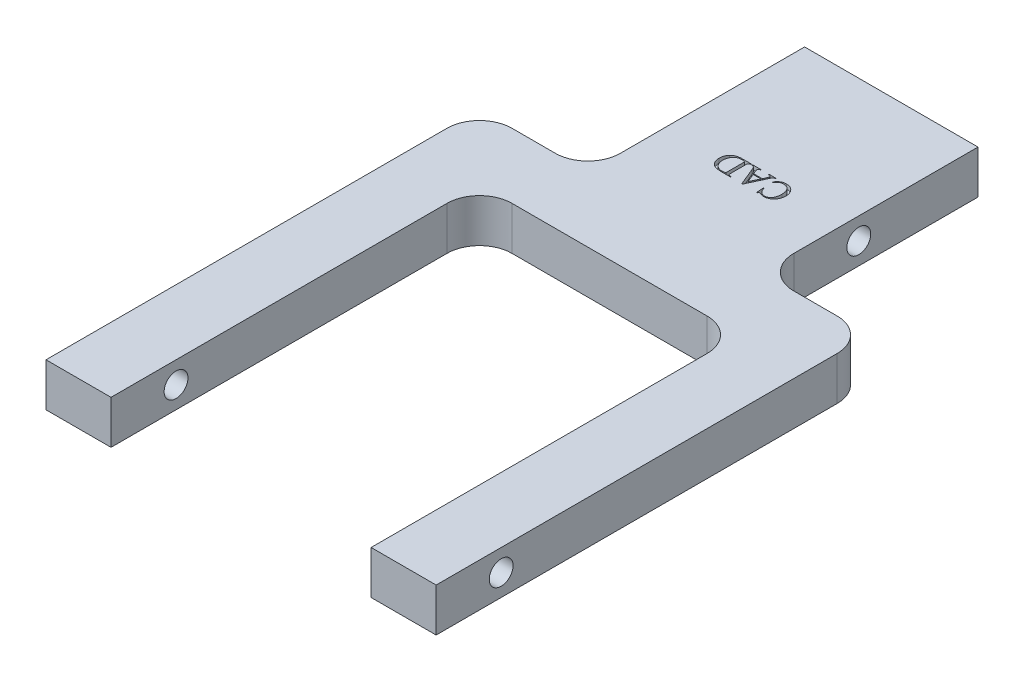
from build123d import *

# Parameters (mm, degrees)
SKETCH1_W           = 40
SKETCH1_H           = 10
BOSS_EXTRUDE1_DEPTH = 25
SKETCH2_R           = 2.75
CUT_EXTRUDE1_DEPTH  = 48.434164903
SKETCH3_W           = 30
SKETCH3_H           = 3.5
CUT_EXTRUDE5_DEPTH  = 15
SKETCH4_W           = 90
SKETCH4_H           = 10
BOSS_EXTRUDE2_DEPTH = 15
SKETCH5_W           = 15
SKETCH5_H           = 10
BOSS_EXTRUDE3_DEPTH = 85
SKETCH6_R           = 2.75
CUT_EXTRUDE6_DEPTH  = 155.110350074
FILLET3_R           = 7.5
CUT_EXTRUDE7_DEPTH  = 1


with BuildPart() as part:
    # Sketch1 → Boss-Extrude1 (new, symmetric)
    with BuildSketch(Plane.XY):
        Rectangle(SKETCH1_W, SKETCH1_H)
    extrude(amount=BOSS_EXTRUDE1_DEPTH, both=True)

    # Sketch2 → Cut-Extrude1 (cut, through all)
    with BuildSketch(Plane(origin=(20, 0, 0), x_dir=(0, 0, -1), z_dir=(1, 0, 0))):
        with Locations((-2.5, 0)):
            Circle(SKETCH2_R)
    extrude(amount=-CUT_EXTRUDE1_DEPTH, mode=Mode.SUBTRACT)

    # Sketch3 → Cut-Extrude5 (cut)
    with BuildSketch(Plane(origin=(0, 0, -25), x_dir=(-1, 0, 0), z_dir=(0, 0, -1))):
        Rectangle(SKETCH3_W, SKETCH3_H)
    extrude(amount=-CUT_EXTRUDE5_DEPTH, mode=Mode.SUBTRACT)

    # Sketch4 → Boss-Extrude2 (add)
    with BuildSketch(Plane.XY.offset(25)):
        Rectangle(SKETCH4_W, SKETCH4_H)
    extrude(amount=BOSS_EXTRUDE2_DEPTH)

    # Sketch5 → Boss-Extrude3 (add)
    with BuildSketch(Plane.XY.offset(40)):
        with Locations((37.5, 0)):
            Rectangle(SKETCH5_W, SKETCH5_H)
        with Locations((-37.5, 0)):
            Rectangle(SKETCH5_W, SKETCH5_H)
    extrude(amount=BOSS_EXTRUDE3_DEPTH)

    # Sketch6 → Cut-Extrude6 (cut, through all)
    with BuildSketch(Plane(origin=(45, 0, 0), x_dir=(0, 0, -1), z_dir=(1, 0, 0))):
        with Locations((-110, 0)):
            Circle(SKETCH6_R)
    extrude(amount=-CUT_EXTRUDE6_DEPTH, mode=Mode.SUBTRACT)

    # Fillet3
    fillet3_edges = [part.edges().sort_by_distance(p)[0] for p in [
        (-20, 0, 25),
        (45, 0, 25),
        (-45, 0, 25),
        (20, 0, 25),
        (30, 0, 40),
        (-30, 0, 40),
    ]]
    fillet(fillet3_edges, radius=FILLET3_R)

    # Sketch7 → Cut-Extrude7 (cut)
    # profile 1 of 3: a face of its own
    with BuildSketch(Plane(origin=(0, 5, 0), x_dir=(1, 0, 0), z_dir=(0, 1, 0))):
        with BuildLine():
            Line((-2.569444444, -4.5387533), (-2.569444444, -4.677642189))
            Line((-2.569444444, -4.677642189), (-2.750651042, -4.677642189))
            add(Edge.make_bspline(
                [(-2.750651042, -4.677642189), (-2.775279414, -4.678223436), (-2.822934507, -4.679348131), (-2.891719334, -4.689217602), (-2.955082596, -4.705420327), (-3.013066457, -4.727792017), (-3.064518238, -4.758174983), (-3.112167037, -4.792323509), (-3.152665345, -4.835523338), (-3.174633003, -4.868288522), (-3.185763889, -4.884890453)],
                knots=[0, 0, 0, 0, 1.170016541, 2.263943595, 3.293731011, 4.273677885, 5.205400736, 6.126759273, 7.050839703, 8, 8, 8, 8], degree=3))
            add(Edge.make_bspline(
                [(-3.185763889, -4.884890453), (-3.192335985, -4.896643602), (-3.206746118, -4.922413835), (-3.220419621, -4.9691846), (-3.235126368, -5.023907993), (-3.245231439, -5.089041108), (-3.254168472, -5.163191039), (-3.258624688, -5.247641899), (-3.263769489, -5.341283438), (-3.263847952, -5.407160924), (-3.263888889, -5.441531078)],
                knots=[0, 0, 0, 0, 0.568271533, 1.246005618, 2.051701561, 2.967781669, 4.031140767, 5.212374137, 6.545616439, 8, 8, 8, 8], degree=3))
            Line((-3.263888889, -5.441531078), (-3.263888889, -8.635975523))
            add(Edge.make_bspline(
                [(-3.263888889, -8.635975523), (-3.263939844, -8.673964874), (-3.264036478, -8.746010274), (-3.257815317, -8.848727956), (-3.251005434, -8.940399074), (-3.240368143, -9.020855699), (-3.226502492, -9.090257047), (-3.209226597, -9.148166296), (-3.190986458, -9.196874721), (-3.172541565, -9.222204678), (-3.1640625, -9.233848786)],
                knots=[0, 0, 0, 0, 1.484107705, 2.814555366, 4.019988359, 5.075390106, 5.984573864, 6.780592097, 7.4394417, 8, 8, 8, 8], degree=3))
            add(Edge.make_bspline(
                [(-3.1640625, -9.233848786), (-3.139179083, -9.259522401), (-3.08915632, -9.311133687), (-2.99050509, -9.363717258), (-2.875796819, -9.394037885), (-2.793897101, -9.397850965), (-2.750651042, -9.399864411)],
                knots=[0, 0, 0, 0, 0.928124107, 1.865794122, 2.873060895, 4, 4, 4, 4], degree=3))
            Line((-2.750651042, -9.399864411), (-2.569444444, -9.399864411))
            Line((-2.569444444, -9.399864411), (-2.569444444, -9.5387533))
            Line((-2.569444444, -9.5387533), (-4.618055556, -9.5387533))
            add(Edge.make_bspline(
                [(-4.618055556, -9.5387533), (-4.709217029, -9.537903581), (-4.886195185, -9.536253961), (-5.143118156, -9.52404701), (-5.383244109, -9.50554594), (-5.606028182, -9.476484729), (-5.812968091, -9.443448276), (-6.002428102, -9.398173815), (-6.175916338, -9.348338492), (-6.33345359, -9.287997745), (-6.478345795, -9.217142738), (-6.615654005, -9.138259399), (-6.745206063, -9.047790767), (-6.867211866, -8.94620789), (-6.98210886, -8.834395531), (-7.090177338, -8.712417275), (-7.189966577, -8.57917603), (-7.282835584, -8.436977241), (-7.366447664, -8.286204811), (-7.438868838, -8.128648648), (-7.501602852, -7.965457969), (-7.550212136, -7.795913844), (-7.592063785, -7.621760972), (-7.617441879, -7.441145349), (-7.636341978, -7.255081517), (-7.638031324, -7.128865924), (-7.638888889, -7.064794967)],
                knots=[0, 0, 0, 0, 1.467309949, 2.848591598, 4.139497657, 5.342553095, 6.464297726, 7.51072298, 8.47600449, 9.367994864, 10.222053623, 11.069838677, 11.914519565, 12.762064703, 13.622548391, 14.492823971, 15.382417182, 16.299624489, 17.224742868, 18.154684933, 19.088899858, 20.035781888, 20.991872468, 21.969210541, 22.969108178, 24, 24, 24, 24], degree=3))
            add(Edge.make_bspline(
                [(-7.638888889, -7.064794967), (-7.637206894, -6.979336969), (-7.633910105, -6.811835368), (-7.602258339, -6.566110861), (-7.552818592, -6.331113744), (-7.483441138, -6.10630896), (-7.392924594, -5.892709564), (-7.282238983, -5.690048254), (-7.154063172, -5.496248042), (-7.05213786, -5.378987122), (-7.000868056, -5.3200033)],
                knots=[0, 0, 0, 0, 1.077719575, 2.112379846, 3.120154608, 4.104514829, 5.075810074, 6.041644454, 7.014920789, 8, 8, 8, 8], degree=3))
            add(Edge.make_bspline(
                [(-7.000868056, -5.3200033), (-6.970538358, -5.28811665), (-6.909663439, -5.224116763), (-6.810744866, -5.135632649), (-6.706475699, -5.052890076), (-6.596150824, -4.976641552), (-6.480273609, -4.906245886), (-6.358293029, -4.841792594), (-6.229963595, -4.784842409), (-6.096591667, -4.732352874), (-5.956931753, -4.687013259), (-5.811844638, -4.646785189), (-5.660470902, -4.613041494), (-5.503191717, -4.586477308), (-5.340393619, -4.564449101), (-5.171679171, -4.549408405), (-4.997196497, -4.540854476), (-4.878843233, -4.539460549), (-4.818793403, -4.5387533)],
                knots=[0, 0, 0, 0, 0.884547214, 1.775380039, 2.665826882, 3.559504879, 4.469980105, 5.390593375, 6.331323642, 7.291529335, 8.271228182, 9.282197471, 10.317896576, 11.387954191, 12.488469157, 13.620281033, 14.792583212, 16, 16, 16, 16], degree=3))
            Line((-4.818793403, -4.5387533), (-2.569444444, -4.5387533))
        make_face()
        with BuildLine():
            add(Edge.make_bspline(
                [(-3.958333333, -4.853423439), (-4.03524838, -4.837210695), (-4.182052914, -4.806266108), (-4.393782302, -4.77235583), (-4.586166801, -4.751501897), (-4.70807228, -4.74850262), (-4.765625, -4.747086634)],
                knots=[0, 0, 0, 0, 1.156186088, 2.206764045, 3.153396487, 4, 4, 4, 4], degree=3))
            add(Edge.make_bspline(
                [(-4.765625, -4.747086634), (-4.837347443, -4.748875125), (-4.978514194, -4.752395299), (-5.185233192, -4.782781403), (-5.383181103, -4.830125118), (-5.571728673, -4.897632144), (-5.750787292, -4.984903715), (-5.920084231, -5.092254473), (-6.079707515, -5.21878), (-6.229663853, -5.36259793), (-6.36443628, -5.524101895), (-6.484121787, -5.699234254), (-6.582477637, -5.889669503), (-6.66432387, -6.092706277), (-6.728460393, -6.309576542), (-6.773478375, -6.540620776), (-6.801103643, -6.785256903), (-6.804048816, -6.952958011), (-6.805555556, -7.0387533)],
                knots=[0, 0, 0, 0, 0.997895983, 1.964095595, 2.901912071, 3.827157005, 4.745844758, 5.669115072, 6.611891721, 7.576831244, 8.556021548, 9.534901163, 10.52350778, 11.533221663, 12.578230165, 13.66632696, 14.806101182, 16, 16, 16, 16], degree=3))
            add(Edge.make_bspline(
                [(-6.805555556, -7.0387533), (-6.804052407, -7.125270761), (-6.801120003, -7.294052666), (-6.773600675, -7.539796335), (-6.728306931, -7.771506944), (-6.664299011, -7.989105591), (-6.582740298, -8.193012427), (-6.484064336, -8.38366443), (-6.364715207, -8.558685555), (-6.229592618, -8.719622668), (-6.078510606, -8.86195916), (-5.917737167, -8.987863957), (-5.745829436, -9.093793193), (-5.56381569, -9.181264927), (-5.370829487, -9.24851826), (-5.167916951, -9.296144389), (-4.954886889, -9.324837493), (-4.809479304, -9.328533176), (-4.735243056, -9.330419967)],
                knots=[0, 0, 0, 0, 1.193214436, 2.327772974, 3.406156071, 4.446620407, 5.451949753, 6.431730845, 7.40187177, 8.368503246, 9.324984719, 10.260197277, 11.181043279, 12.105006845, 13.040804909, 13.994510132, 14.976119128, 16, 16, 16, 16], degree=3))
            add(Edge.make_bspline(
                [(-4.735243056, -9.330419967), (-4.676231168, -9.329162939), (-4.554253075, -9.32656465), (-4.365476164, -9.304298137), (-4.1651707, -9.269828135), (-4.028705476, -9.237499253), (-3.958333333, -9.220827953)],
                knots=[0, 0, 0, 0, 0.900167399, 1.860653943, 2.896785853, 4, 4, 4, 4], degree=3))
            Line((-3.958333333, -9.220827953), (-3.958333333, -4.853423439))
        make_face(mode=Mode.SUBTRACT)
    # profile 2 of 3: a face of its own
    with BuildSketch(Plane(origin=(0, 5, 0), x_dir=(1, 0, 0), z_dir=(0, 1, 0))):
        with BuildLine():
            Line((-0.553385417, -6.205419967), (1.439887153, -6.205419967))
            Line((1.439887153, -6.205419967), (1.805555556, -5.41765955))
            add(Edge.make_bspline(
                [(1.805555556, -5.41765955), (1.824288099, -5.373041598), (1.858970767, -5.290432976), (1.897475604, -5.173632851), (1.924774062, -5.075277528), (1.928624528, -5.014864558), (1.930338542, -4.98797205)],
                knots=[0, 0, 0, 0, 1.290167615, 2.388701517, 3.282739186, 4, 4, 4, 4], degree=3))
            add(Edge.make_bspline(
                [(1.930338542, -4.98797205), (1.929239386, -4.969302809), (1.927055127, -4.932203023), (1.904338615, -4.879571704), (1.869741965, -4.830716734), (1.829996229, -4.794427831), (1.790224682, -4.76656627), (1.75045646, -4.749191229), (1.704102735, -4.731219303), (1.649181519, -4.718089387), (1.586991732, -4.704937755), (1.516880876, -4.692694225), (1.438510436, -4.68480877), (1.383829365, -4.680102039), (1.355251736, -4.677642189)],
                knots=[0, 0, 0, 0, 0.929259441, 1.846637774, 2.820631512, 3.908950412, 4.521279175, 5.241717073, 6.07196532, 7.006846041, 8.060926705, 9.253889166, 10.564817138, 12, 12, 12, 12], degree=3))
            Line((1.355251736, -4.677642189), (1.355251736, -4.5387533))
            Line((1.355251736, -4.5387533), (2.925347222, -4.5387533))
            Line((2.925347222, -4.5387533), (2.925347222, -4.677642189))
            add(Edge.make_bspline(
                [(2.925347222, -4.677642189), (2.877672149, -4.686720453), (2.790826187, -4.703257617), (2.676733804, -4.739937533), (2.586071093, -4.775585691), (2.542087547, -4.811584561), (2.522786458, -4.827381773)],
                knots=[0, 0, 0, 0, 1.338419352, 2.438094121, 3.314596311, 4, 4, 4, 4], degree=3))
            add(Edge.make_bspline(
                [(2.522786458, -4.827381773), (2.50658002, -4.844487404), (2.472102733, -4.88087762), (2.423141844, -4.944837932), (2.373699828, -5.020956987), (2.323078756, -5.108837632), (2.270790897, -5.208462393), (2.216817202, -5.319370004), (2.162536998, -5.443085122), (2.126914148, -5.529707172), (2.108289931, -5.57499462)],
                knots=[0, 0, 0, 0, 0.657509844, 1.398774721, 2.244567789, 3.190193186, 4.229071695, 5.385194885, 6.63293641, 8, 8, 8, 8], degree=3))
            Line((2.108289931, -5.57499462), (0.233289931, -9.608197745))
            Line((0.233289931, -9.608197745), (0.096571181, -9.608197745))
            Line((0.096571181, -9.608197745), (-1.597222222, -5.487103995))
            add(Edge.make_bspline(
                [(-1.597222222, -5.487103995), (-1.613860368, -5.447516524), (-1.645859565, -5.3713802), (-1.697738836, -5.264296054), (-1.745503316, -5.166590305), (-1.793519951, -5.080527877), (-1.839955181, -5.005368161), (-1.885412105, -4.941051308), (-1.929683964, -4.887319983), (-1.988010143, -4.830298387), (-2.069103635, -4.772608621), (-2.182244256, -4.724750366), (-2.310467224, -4.690343926), (-2.402112277, -4.682006619), (-2.450086806, -4.677642189)],
                knots=[0, 0, 0, 0, 1.223989839, 2.354029848, 3.391605643, 4.324042249, 5.162387765, 5.909171864, 6.567979791, 7.144041755, 8.231258465, 9.380841669, 10.628917946, 12, 12, 12, 12], degree=3))
            Line((-2.450086806, -4.677642189), (-2.450086806, -4.5387533))
            Line((-2.450086806, -4.5387533), (-0.476345486, -4.5387533))
            Line((-0.476345486, -4.5387533), (-0.476345486, -4.677642189))
            add(Edge.make_bspline(
                [(-0.476345486, -4.677642189), (-0.522015317, -4.680733552), (-0.605504443, -4.686384879), (-0.7189454, -4.706382741), (-0.809302456, -4.734922252), (-0.876871958, -4.775158572), (-0.924315849, -4.822817981), (-0.957622593, -4.874613511), (-0.978421862, -4.931487117), (-0.980790216, -4.971163619), (-0.981987847, -4.991227259)],
                knots=[0, 0, 0, 0, 1.654549464, 3.02468584, 4.158188686, 5.062333725, 5.839340438, 6.568748979, 7.276244049, 8, 8, 8, 8], degree=3))
            add(Edge.make_bspline(
                [(-0.981987847, -4.991227259), (-0.980038239, -5.023199557), (-0.975594755, -5.096069792), (-0.943177106, -5.215618348), (-0.898558521, -5.359760603), (-0.857661232, -5.462060716), (-0.835503472, -5.517485939)],
                knots=[0, 0, 0, 0, 0.698820548, 1.592729354, 2.695763756, 4, 4, 4, 4], degree=3))
            Line((-0.835503472, -5.517485939), (-0.553385417, -6.205419967))
        make_face()
        Polygon((-0.467664931, -6.4137533), (0.381944444, -8.421131773), (1.343315972, -6.4137533), align=None, mode=Mode.SUBTRACT)
    # profile 3 of 3: a face of its own
    with BuildSketch(Plane(origin=(0, 5, 0), x_dir=(1, 0, 0), z_dir=(0, 1, 0))):
        with BuildLine():
            Line((3.541666667, -9.608197745), (3.402777778, -7.872086634))
            Line((3.402777778, -7.872086634), (3.541666667, -7.872086634))
            add(Edge.make_bspline(
                [(3.541666667, -7.872086634), (3.560126941, -7.937773362), (3.595891037, -8.065031849), (3.659675652, -8.246937582), (3.726844004, -8.415391471), (3.802519558, -8.568985834), (3.882019441, -8.709155501), (3.968017104, -8.835089046), (4.060421917, -8.946148456), (4.158529011, -9.043597937), (4.262682039, -9.127463524), (4.371155915, -9.200971004), (4.486025635, -9.261191183), (4.60447399, -9.313171977), (4.728906007, -9.352388335), (4.858479299, -9.378544956), (4.99258734, -9.397290197), (5.083844683, -9.398997175), (5.130208333, -9.399864411)],
                knots=[0, 0, 0, 0, 1.364873113, 2.644243229, 3.855072259, 4.991098394, 6.067349114, 7.077040626, 8.037909632, 8.953908962, 9.838879952, 10.709983037, 11.571169724, 12.430194802, 13.295355634, 14.175341501, 15.072975092, 16, 16, 16, 16], degree=3))
            add(Edge.make_bspline(
                [(5.130208333, -9.399864411), (5.169290863, -9.39885386), (5.246516078, -9.396857058), (5.360848817, -9.386304235), (5.472263869, -9.366707799), (5.580414165, -9.338083057), (5.686382209, -9.303353493), (5.789752129, -9.261320208), (5.889539878, -9.209849524), (5.98666041, -9.151196475), (6.079880084, -9.084112532), (6.168505921, -9.007860803), (6.25060759, -8.921265448), (6.329605491, -8.827256914), (6.400616622, -8.721468773), (6.469480852, -8.608513617), (6.530573745, -8.484815682), (6.588919588, -8.35358032), (6.639143001, -8.212637772), (6.683877653, -8.063467898), (6.721601477, -7.905842607), (6.753192595, -7.7397098), (6.776947702, -7.565119583), (6.79233162, -7.382197895), (6.804169675, -7.191539222), (6.805087853, -7.061559574), (6.805555556, -6.995350523)],
                knots=[0, 0, 0, 0, 0.852505896, 1.68451098, 2.501535993, 3.316578488, 4.122291864, 4.932356836, 5.747284808, 6.568449952, 7.404744231, 8.249220066, 9.113937073, 10.004741055, 10.923703779, 11.889609467, 12.887953243, 13.929967559, 15.020390426, 16.148425559, 17.325058432, 18.5534359, 19.835232325, 21.165715763, 22.556271901, 24, 24, 24, 24], degree=3))
            add(Edge.make_bspline(
                [(6.805555556, -6.995350523), (6.804943208, -6.940359961), (6.803737664, -6.832098533), (6.793860298, -6.672783197), (6.777427597, -6.518949096), (6.755461432, -6.37060001), (6.724144783, -6.228254096), (6.689277993, -6.090878482), (6.645132704, -5.959805707), (6.596797425, -5.83377984), (6.541954938, -5.713954485), (6.478118183, -5.602394015), (6.410449393, -5.496171037), (6.3336758, -5.398525247), (6.251405003, -5.307122435), (6.162090189, -5.222840357), (6.065017826, -5.147481682), (5.963189463, -5.077604951), (5.856046578, -5.016202359), (5.744922302, -4.962302538), (5.629332059, -4.918761524), (5.511140541, -4.87939438), (5.388074547, -4.852262342), (5.26175313, -4.831035433), (5.131514835, -4.819301351), (5.043423753, -4.817460955), (4.998914931, -4.816531078)],
                knots=[0, 0, 0, 0, 1.236759784, 2.434842964, 3.588349432, 4.715860666, 5.805615806, 6.865196721, 7.901921737, 8.914099287, 9.900448344, 10.862065106, 11.802985303, 12.730517238, 13.6520364, 14.567105624, 15.488229724, 16.413332625, 17.342646563, 18.263195724, 19.18776195, 20.119067684, 21.062341108, 22.018574871, 22.998866869, 24, 24, 24, 24], degree=3))
            add(Edge.make_bspline(
                [(4.998914931, -4.816531078), (4.922799118, -4.81860676), (4.773966265, -4.82266544), (4.557884156, -4.860718874), (4.355251978, -4.921163379), (4.196194366, -4.993347739), (4.074860643, -5.067590629), (3.980806535, -5.134019572), (3.885754729, -5.213843533), (3.787987089, -5.305147108), (3.688371129, -5.408972225), (3.584882083, -5.52353358), (3.481463369, -5.651947393), (3.413030322, -5.742277839), (3.377821181, -5.7887533)],
                knots=[0, 0, 0, 0, 1.384369864, 2.706923932, 3.979392615, 5.225429667, 5.872362172, 6.566477539, 7.319183729, 8.12964106, 9.000244434, 9.937306366, 10.938733914, 12, 12, 12, 12], degree=3))
            Line((3.377821181, -5.7887533), (3.263888889, -5.719308856))
            add(Edge.make_bspline(
                [(3.263888889, -5.719308856), (3.294464486, -5.666901039), (3.354617403, -5.563796491), (3.452066178, -5.417798017), (3.553279422, -5.282814518), (3.657392782, -5.158353063), (3.76648462, -5.045249252), (3.878668853, -4.942007421), (3.995389233, -4.850631384), (4.115549529, -4.769316647), (4.241107648, -4.699052681), (4.371307079, -4.63599142), (4.508705241, -4.586551701), (4.650012109, -4.541483475), (4.798441976, -4.509973075), (4.951977029, -4.485944555), (5.111483635, -4.471455939), (5.219516047, -4.470033245), (5.274522569, -4.469308856)],
                knots=[0, 0, 0, 0, 1.164362939, 2.290710074, 3.366728646, 4.401351105, 5.402933561, 6.380778175, 7.325127368, 8.24546693, 9.162501662, 10.084750509, 11.018321451, 11.962543056, 12.929359786, 13.92689231, 14.944442286, 16, 16, 16, 16], degree=3))
            add(Edge.make_bspline(
                [(5.274522569, -4.469308856), (5.324096727, -4.469813829), (5.421921899, -4.470810297), (5.56638095, -4.482319974), (5.706963831, -4.499352734), (5.843346858, -4.523840525), (5.975062745, -4.557574726), (6.103441395, -4.594001547), (6.226329856, -4.642013516), (6.34551672, -4.694431757), (6.460321814, -4.754783843), (6.571088451, -4.821846414), (6.67730899, -4.896997806), (6.779457497, -4.978527802), (6.8776781, -5.066559628), (6.97092707, -5.162776859), (7.061207281, -5.265022872), (7.116361323, -5.338427884), (7.144097222, -5.375341842)],
                knots=[0, 0, 0, 0, 1.099867591, 2.170379506, 3.21370673, 4.241732154, 5.242319988, 6.230208013, 7.200627964, 8.167156574, 9.118536317, 10.076596279, 11.038581839, 12.003776478, 12.975622664, 13.963217193, 14.975741399, 16, 16, 16, 16], degree=3))
            add(Edge.make_bspline(
                [(7.144097222, -5.375341842), (7.183731992, -5.432244741), (7.26253696, -5.545383563), (7.363995137, -5.72562952), (7.448216064, -5.913752082), (7.518407856, -6.109161375), (7.572210255, -6.312165634), (7.611598294, -6.52244659), (7.634601811, -6.740203997), (7.637445885, -6.88787453), (7.638888889, -6.962798439)],
                knots=[0, 0, 0, 0, 0.983430026, 1.955332979, 2.929117015, 3.904576077, 4.897850039, 5.905285016, 6.937200057, 8, 8, 8, 8], degree=3))
            add(Edge.make_bspline(
                [(7.638888889, -6.962798439), (7.637634111, -7.023579194), (7.635151134, -7.143853317), (7.621765542, -7.322698129), (7.594672571, -7.497040556), (7.560636052, -7.668711028), (7.514552656, -7.835798278), (7.460933278, -8.000251258), (7.393599954, -8.159224161), (7.319701515, -8.315139789), (7.236251461, -8.464419397), (7.145155731, -8.606206964), (7.04540195, -8.738287077), (6.937849455, -8.861659712), (6.824757599, -8.978049014), (6.702438144, -9.084546366), (6.573049193, -9.18250361), (6.436615258, -9.271179084), (6.295107599, -9.349968111), (6.14976192, -9.418851185), (6.001249363, -9.477571274), (5.848942503, -9.525388649), (5.693732783, -9.562350115), (5.535240544, -9.588113404), (5.373637331, -9.605198527), (5.264438919, -9.607192876), (5.209418403, -9.608197745)],
                knots=[0, 0, 0, 0, 1.092124827, 2.161117569, 3.218833616, 4.259973422, 5.303462702, 6.330865502, 7.36502693, 8.402591856, 9.429439709, 10.435161576, 11.428038879, 12.3999641, 13.374080665, 14.341106325, 15.310595748, 16.287439179, 17.261902436, 18.21817108, 19.175035605, 20.128607103, 21.083704972, 22.038714422, 23.011790172, 24, 24, 24, 24], degree=3))
            add(Edge.make_bspline(
                [(5.209418403, -9.608197745), (5.123164417, -9.605822466), (4.950446338, -9.601066123), (4.692968966, -9.558225775), (4.436391108, -9.49365829), (4.270945199, -9.428482195), (4.187282986, -9.395524134)],
                knots=[0, 0, 0, 0, 0.984376883, 1.971151638, 2.974057776, 4, 4, 4, 4], degree=3))
            add(Edge.make_bspline(
                [(4.187282986, -9.395524134), (4.164571657, -9.385928184), (4.123098318, -9.368404943), (4.065485938, -9.347116881), (4.017828306, -9.334228348), (3.989125724, -9.331565411), (3.976779514, -9.330419967)],
                knots=[0, 0, 0, 0, 1.336058692, 2.439787325, 3.328885714, 4, 4, 4, 4], degree=3))
            add(Edge.make_bspline(
                [(3.976779514, -9.330419967), (3.94627596, -9.332653101), (3.886010248, -9.337065092), (3.835639453, -9.370387395), (3.810763889, -9.386843578)],
                knots=[0, 0, 0, 0, 1.012302122, 2, 2, 2, 2], degree=3))
            add(Edge.make_bspline(
                [(3.810763889, -9.386843578), (3.796144218, -9.400857814), (3.766496033, -9.429278198), (3.730580898, -9.481686891), (3.701093528, -9.541689149), (3.687550799, -9.585544885), (3.680555556, -9.608197745)],
                knots=[0, 0, 0, 0, 0.931005674, 1.888047171, 2.909110262, 4, 4, 4, 4], degree=3))
            Line((3.680555556, -9.608197745), (3.541666667, -9.608197745))
        make_face()
    extrude(amount=-CUT_EXTRUDE7_DEPTH, mode=Mode.SUBTRACT)


solid = part.part
